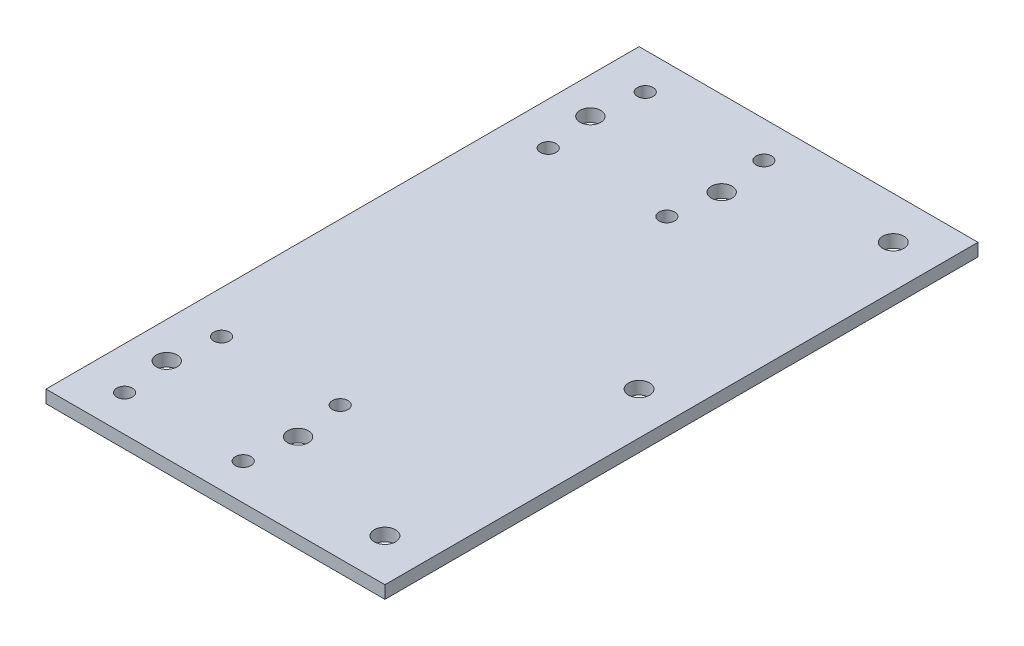
from build123d import *

# Parameters (mm, degrees)
SKETCH_1_R      = 2.5
SKETCH_1_R_2    = 2.45
SKETCH_1_R_3    = 1.85
SKETCH_1_W      = 48
SKETCH_1_H      = 40
EXTRUDE_1_DEPTH = 3


with BuildPart() as part:
    # 草图1 → 凸台-拉伸1 (new body)
    # profile 1 of 5: a face of its own
    with BuildSketch(Plane(origin=(0, 0, 0), x_dir=(1, 0, 0), z_dir=(0, 1, 0))):
        with BuildLine():
            Line((8, -30), (8, -70))
            Line((8, -70), (40, -70))
            Line((40, -70), (40, 60))
            Line((40, 60), (32.5, 60))
            ThreePointArc((32.5, 60), (28.232233047, 58.232233047), (30, 62.5))
            Line((30, 62.5), (30, 70))
            Line((30, 70), (8, 70))
            Line((8, 70), (8, 30))
            Line((8, 30), (-40, 30))
            Line((-40, 30), (-40, -30))
            Line((-40, -30), (8, -30))
        make_face()
        with Locations(Location((30, -60, 0), (0, 0, 270))):
            Circle(SKETCH_1_R, mode=Mode.SUBTRACT)
        with Locations(Location((30, 0, 0), (0, 0, 270))):
            Circle(SKETCH_1_R, mode=Mode.SUBTRACT)
    # profile 2 of 5: a face of its own
    with BuildSketch(Plane(origin=(0, 0, 0), x_dir=(1, 0, 0), z_dir=(0, 1, 0))):
        with BuildLine():
            Line((32.5, 60), (40, 60))
            Line((40, 60), (40, 70))
            Line((40, 70), (30, 70))
            Line((30, 70), (30, 62.5))
            ThreePointArc((30, 62.5), (31.767766953, 61.767766953), (32.5, 60))
        make_face()
    # profile 3 of 5: a face of its own
    with BuildSketch(Plane(origin=(0, 0, 0), x_dir=(1, 0, 0), z_dir=(0, 1, 0))):
        with BuildLine():
            Line((-40, 61.45), (-40, 30))
            Line((-40, 30), (8, 30))
            Line((8, 30), (8, 70))
            Line((8, 70), (-30, 70))
            Line((-30, 70), (-30, 63.3))
            ThreePointArc((-30, 63.3), (-28.691852455, 62.758147545), (-28.15, 61.45))
            ThreePointArc((-28.15, 61.45), (-30, 59.6), (-31.85, 61.45))
            Line((-31.85, 61.45), (-40, 61.45))
        make_face()
        with Locations(Location((-31.5, 50, 0), (0, 0, 270))):
            Circle(SKETCH_1_R_2, mode=Mode.SUBTRACT)
        with Locations(Location((-30, 38.55, 0), (0, 0, 270))):
            Circle(SKETCH_1_R_3, mode=Mode.SUBTRACT)
        with Locations(Location((-2, 38.55, 0), (0, 0, 270))):
            Circle(SKETCH_1_R_3, mode=Mode.SUBTRACT)
        with Locations(Location((-0.5, 50, 0), (0, 0, 270))):
            Circle(SKETCH_1_R_2, mode=Mode.SUBTRACT)
        with Locations(Location((-2, 61.45, 0), (0, 0, 270))):
            Circle(SKETCH_1_R_3, mode=Mode.SUBTRACT)
    # profile 4 of 5: a face of its own
    with BuildSketch(Plane(origin=(0, 0, 0), x_dir=(1, 0, 0), z_dir=(0, 1, 0))):
        with BuildLine():
            Line((-40, 70), (-40, 61.45))
            Line((-40, 61.45), (-31.85, 61.45))
            ThreePointArc((-31.85, 61.45), (-31.308147545, 62.758147545), (-30, 63.3))
            Line((-30, 63.3), (-30, 70))
            Line((-30, 70), (-40, 70))
        make_face()
    # profile 5 of 5: a face of its own
    with BuildSketch(Plane(origin=(0, 0, 0), x_dir=(1, 0, 0), z_dir=(0, 1, 0))):
        with Locations((-16, -50)):
            Rectangle(SKETCH_1_W, SKETCH_1_H)
        with Locations(Location((-30, -61.45, 0), (0, 0, 270))):
            Circle(SKETCH_1_R_3, mode=Mode.SUBTRACT)
        with Locations(Location((-31.5, -50, 0), (0, 0, 270))):
            Circle(SKETCH_1_R_2, mode=Mode.SUBTRACT)
        with Locations(Location((-30, -38.55, 0), (0, 0, 270))):
            Circle(SKETCH_1_R_3, mode=Mode.SUBTRACT)
        with Locations(Location((-2, -61.45, 0), (0, 0, 270))):
            Circle(SKETCH_1_R_3, mode=Mode.SUBTRACT)
        with Locations(Location((-0.5, -50, 0), (0, 0, 270))):
            Circle(SKETCH_1_R_2, mode=Mode.SUBTRACT)
        with Locations(Location((-2, -38.55, 0), (0, 0, 270))):
            Circle(SKETCH_1_R_3, mode=Mode.SUBTRACT)
    extrude(amount=EXTRUDE_1_DEPTH)


solid = part.part
